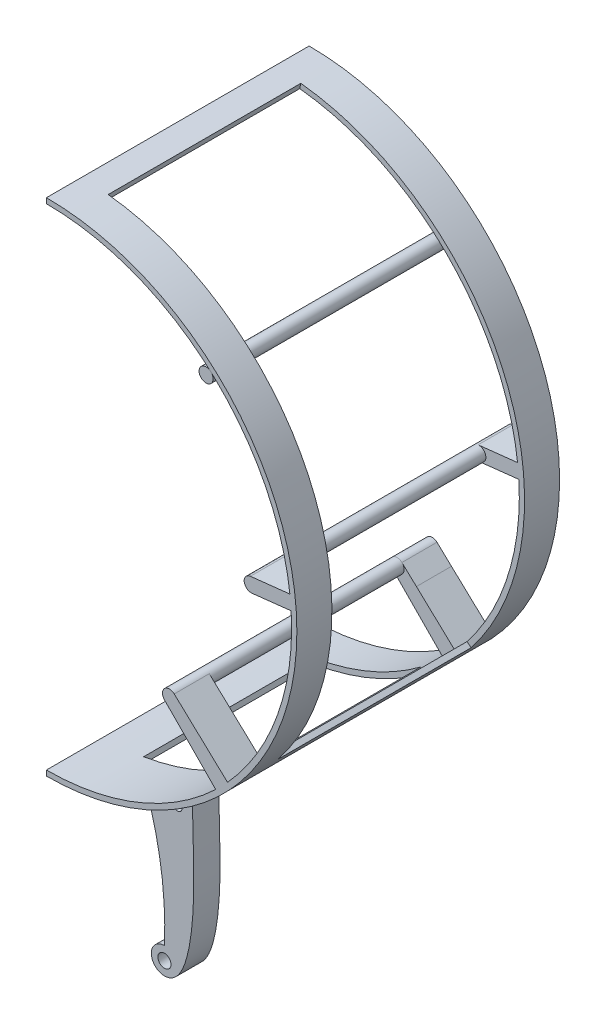
from build123d import *

# Parameters (mm, degrees)
BOSS_EXTRUDE1_DEPTH            = 75
SKETCH2_R                      = 3.75
SKETCH2_R_2                    = 2.5
BOSS_EXTRUDE2_DEPTH            = 7.5
SKETCH4_R                      = 4
BOSS_EXTRUDE3_DEPTH            = 75
BOSS_EXTRUDE3_2_DEPTH          = 75
BOSS_EXTRUDE3_3_DEPTH          = 75
BOSS_EXTRUDE4_DEPTH            = 20
BOSS_EXTRUDE5_START            = -20
BOSS_EXTRUDE5_DEPTH            = 20
CUT_EXTRUDE1_REACH             = 279.369
CUT_EXTRUDE1_DIRECTION_2_REACH = 279.369
CUT_EXTRUDE3_START             = 42.6
CUT_EXTRUDE3_DEPTH             = 97.6


with BuildPart() as part:
    # Sketch1 → Boss-Extrude1 (new, symmetric)
    with BuildSketch(Plane.XY):
        with BuildLine():
            Line((0, -143), (0, -140))
            ThreePointArc((0, -140), (140, 0), (0, 140))
            Line((0, 140), (0, 143))
            ThreePointArc((0, 143), (143, 0), (0, -143))
        make_face()
    extrude(amount=BOSS_EXTRUDE1_DEPTH, both=True)

    # Sketch2 → Boss-Extrude2 (add, symmetric)
    with BuildSketch(Plane.XY.offset(50.1)):
        with BuildLine():
            Line((39.363217393, -137.475587347), (65.554031459, -126.341679479))
            add(Edge.make_bspline(
                [(50, -225.520515721), (63.887998116, -225.556737142), (66.67238478, -185.518594671), (66.828546925, -159.226599882), (65.837335245, -126.434753235), (65.554031459, -126.341679479)],
                knots=[0, 0, 0, 0, 0.384311141, 0.484311141, 1, 1, 1, 1], degree=3))
            ThreePointArc((50, -225.520515721), (42.498579173, -218.019094893), (50, -210.517674065))
            add(Edge.make_bspline(
                [(50, -210.517674065), (51.57981302, -173.041328894), (39.363217393, -137.475587347)],
                knots=[0, 0, 0, 1, 1, 1], degree=2))
        make_face()
        with Locations((50, -218.019094893)):
            Circle(SKETCH2_R, mode=Mode.SUBTRACT)
        with Locations((57.491500901, -137.736557679)):
            Circle(SKETCH2_R_2, mode=Mode.SUBTRACT)
    extrude(amount=BOSS_EXTRUDE2_DEPTH, both=True)



with BuildPart() as body_2:
    # Sketch4 → Boss-Extrude3 (new, symmetric)
    with BuildSketch(Plane.XY):
        with Locations((91.162122312, 100.923076923)):
            Circle(SKETCH4_R)
    extrude(amount=BOSS_EXTRUDE3_DEPTH, both=True)


with BuildPart() as body_3:
    # Sketch4 → Boss-Extrude3 2 (new, symmetric)
    with BuildSketch(Plane.XY):
        with Locations((116.917789305, 10.055391378)):
            Circle(SKETCH4_R)
    extrude(amount=BOSS_EXTRUDE3_2_DEPTH, both=True)


with BuildPart() as body_4:
    # Sketch4 → Boss-Extrude3 3 (new, symmetric)
    with BuildSketch(Plane.XY):
        with Locations((70.2496561, -68.810262197)):
            Circle(SKETCH4_R)
    extrude(amount=BOSS_EXTRUDE3_3_DEPTH, both=True)


with BuildPart() as part_1:
    add(part.part)

    add(body_3.part)  # Boss-Extrude4 merges body 3

    add(body_4.part)  # Boss-Extrude4 merges body 4
    # Sketch5 → Boss-Extrude4 (add)
    with BuildSketch(Plane.XY.offset(75)):
        with BuildLine():
            Line((67.401768733, -71.619094256), (98.381901585, -103.029989292))
            Line((98.381901585, -103.029989292), (105.049019097, -95.905716398))
            Line((105.049019097, -95.905716398), (72.983189134, -65.890022967))
            ThreePointArc((72.983189134, -65.890022967), (67.384549874, -66.018996119), (67.401768733, -71.619094256))
        make_face()
        with BuildLine():
            Line((116.478891692, 14.031239575), (141.138532223, 16.753440429))
            Line((141.138532223, 16.753440429), (142.249629521, 8.874750499))
            Line((142.249629521, 8.874750499), (117.364141838, 6.080373213))
            ThreePointArc((117.364141838, 6.080373213), (112.942354376, 9.612766111), (116.478891692, 14.031239575))
        make_face()
    extrude(amount=-BOSS_EXTRUDE4_DEPTH)

    # Sketch10 → Boss-Extrude5 (add)
    with BuildSketch(Plane(origin=(0, 0, -75), x_dir=(-1, 0, 0), z_dir=(0, 0, -1)).offset(BOSS_EXTRUDE5_START)):
        with BuildLine():
            Line((-81.264011417, -73.641408891), (-72.983462218, -65.889881022))
            ThreePointArc((-72.983462218, -65.889881022), (-67.384311741, -66.01882461), (-67.401694813, -71.619432644))
            Line((-67.401694813, -71.619432644), (-71.715374438, -75.992678343))
            Line((-71.715374438, -75.992678343), (-97.325013163, -101.9559515))
            Line((-97.325013163, -101.9559515), (-103.909527759, -94.839078712))
            Line((-103.909527759, -94.839078712), (-81.264011417, -73.641408891))
        make_face()
        with BuildLine():
            Line((-129.782763697, 15.499866488), (-116.478891692, 14.031239575))
            ThreePointArc((-116.478891692, 14.031239575), (-112.942354376, 9.612766111), (-117.364141838, 6.080373213))
            Line((-117.364141838, 6.080373213), (-131.965987804, 7.720006208))
            Line((-131.965987804, 7.720006208), (-140.617435242, 8.675047607))
            Line((-140.617435242, 8.675047607), (-139.74266415, 16.599349243))
            Line((-139.74266415, 16.599349243), (-129.782763697, 15.499866488))
        make_face()
    extrude(amount=BOSS_EXTRUDE5_DEPTH)

    # Cut-Extrude1: up to this face of the body (flat: up to its plane)
    cut_extrude1_end = Plane(part_1.part.faces().sort_by_distance((86.667869267, -84.804189346, -55))[0])
    # Sketch14 → Cut-Extrude1 (cut, up to the picked face)
    with BuildSketch(Plane.XY, mode=Mode.PRIVATE) as cut_extrude1_sk1:
        with BuildLine():
            Line((110.051344731, -86.371192556), (112.492031713, -88.286707953))
            ThreePointArc((112.492031713, -88.286707953), (135.422167186, -45.932958044), (142.990696216, 1.631194555))
            ThreePointArc((142.990696216, 1.631194555), (132.444265959, 53.921391068), (103.468128704, 98.708390436))
            ThreePointArc((103.468128704, 98.708390436), (63.219337548, 128.266579279), (15.261269183, 142.183310072))
            Line((15.261269183, 142.183310072), (14.625950853, 139.130740465))
            ThreePointArc((14.625950853, 139.130740465), (61.917170318, 125.449373855), (101.540783348, 96.232794295))
            ThreePointArc((101.540783348, 96.232794295), (129.704714642, 52.421068096), (139.890944357, 1.343527996))
            ThreePointArc((139.890944357, 1.343527996), (132.443403079, -45.055813849), (110.051344731, -86.371192556))
        make_face()
    cut_extrude1_tool1 = split(extrude(cut_extrude1_sk1.sketch, amount=-CUT_EXTRUDE1_REACH, mode=Mode.PRIVATE), bisect_by=cut_extrude1_end, keep=Keep.BOTH, mode=Mode.PRIVATE)
    add(cut_extrude1_tool1.solids().sort_by(Axis((17.526377, 140.119485, 0), (0, 0, -1)))[0], mode=Mode.SUBTRACT)

    # Cut-Extrude1 direction 2: up to this face of the body (flat: up to its plane)
    cut_extrude1_direction_2_end = Plane(part_1.part.faces().sort_by_distance((86.668305804, -84.805185214, 55))[0])
    # Sketch14 → Cut-Extrude1 direction 2 (cut, up to the picked face)
    with BuildSketch(Plane.XY, mode=Mode.PRIVATE) as cut_extrude1_direction_2_sk1:
        with BuildLine():
            Line((110.051344731, -86.371192556), (112.492031713, -88.286707953))
            ThreePointArc((112.492031713, -88.286707953), (135.422167186, -45.932958044), (142.990696216, 1.631194555))
            ThreePointArc((142.990696216, 1.631194555), (132.444265959, 53.921391068), (103.468128704, 98.708390436))
            ThreePointArc((103.468128704, 98.708390436), (63.219337548, 128.266579279), (15.261269183, 142.183310072))
            Line((15.261269183, 142.183310072), (14.625950853, 139.130740465))
            ThreePointArc((14.625950853, 139.130740465), (61.917170318, 125.449373855), (101.540783348, 96.232794295))
            ThreePointArc((101.540783348, 96.232794295), (129.704714642, 52.421068096), (139.890944357, 1.343527996))
            ThreePointArc((139.890944357, 1.343527996), (132.443403079, -45.055813849), (110.051344731, -86.371192556))
        make_face()
    cut_extrude1_direction_2_tool1 = split(extrude(cut_extrude1_direction_2_sk1.sketch, amount=CUT_EXTRUDE1_DIRECTION_2_REACH, mode=Mode.PRIVATE), bisect_by=cut_extrude1_direction_2_end, keep=Keep.BOTH, mode=Mode.PRIVATE)
    add(cut_extrude1_direction_2_tool1.solids().sort_by(Axis((17.526377, 140.119485, 0), (0, 0, 1)))[0], mode=Mode.SUBTRACT)

    # Sketch16 → Cut-Extrude3 (cut)
    with BuildSketch(Plane.XY.offset(CUT_EXTRUDE3_START)):
        with BuildLine():
            Line((83.847551975, -112.114174072), (85.644285232, -114.516620659))
            ThreePointArc((85.644285232, -114.516620659), (56.208385431, -131.489989761), (23.598913693, -141.03932527))
            Line((23.598913693, -141.03932527), (23.103831587, -138.080458306))
            ThreePointArc((23.103831587, -138.080458306), (55.029188534, -128.731458507), (83.847551975, -112.114174072))
        make_face()
    extrude(amount=-CUT_EXTRUDE3_DEPTH, mode=Mode.SUBTRACT)


solid = Compound([body_2.part, part_1.part])
